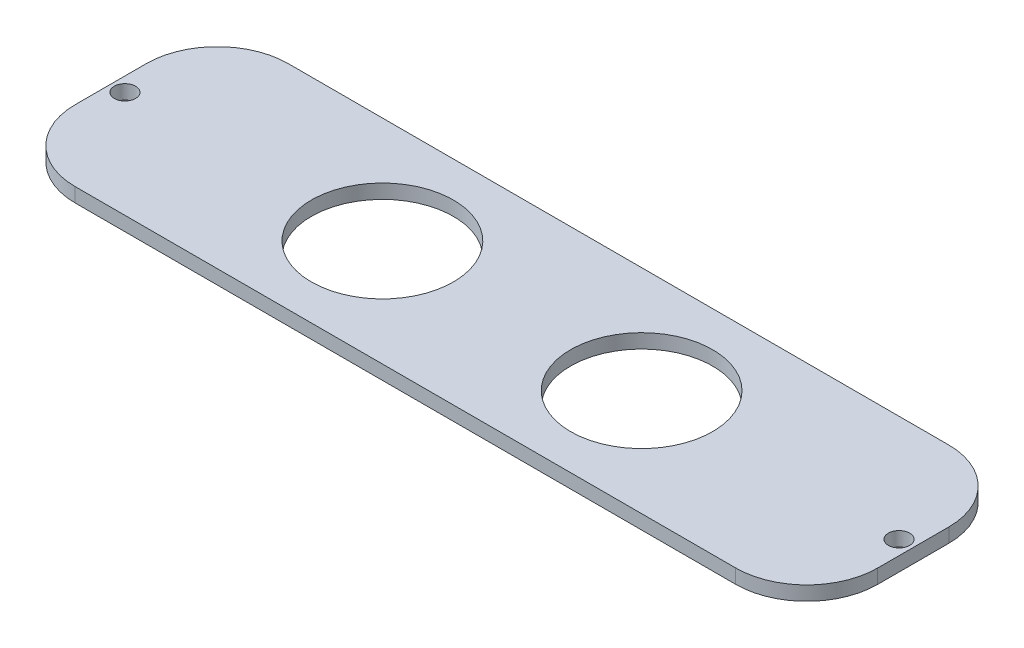
from build123d import *

# Parameters (mm, degrees)
SKETCH_1_R      = 10
SKETCH_1_R_2    = 1.5
EXTRUDE_1_DEPTH = 2


with BuildPart() as part:
    # 草图1 → 凸台-拉伸1 (new body)
    with BuildSketch(Plane(origin=(0, 0, 0), x_dir=(1, 0, 0), z_dir=(0, 1, 0))):
        with BuildLine():
            Line((-46.5, -15), (46.5, -15))
            ThreePointArc((46.5, -15), (53.571067812, -12.071067812), (56.5, -5))
            Line((56.5, -5), (56.5, 5))
            ThreePointArc((56.5, 5), (53.571067812, 12.071067812), (46.5, 15))
            Line((46.5, 15), (-46.5, 15))
            ThreePointArc((-46.5, 15), (-53.571067812, 12.071067812), (-56.5, 5))
            Line((-56.5, 5), (-56.5, -5))
            ThreePointArc((-56.5, -5), (-53.571067812, -12.071067812), (-46.5, -15))
        make_face()
        with Locations(Location((18.25, 0, 0), (0, 0, 270))):
            Circle(SKETCH_1_R, mode=Mode.SUBTRACT)
        with Locations(Location((-18.25, 0, 0), (0, 0, 270))):
            Circle(SKETCH_1_R, mode=Mode.SUBTRACT)
        with Locations(Location((-54.5, 0, 0), (0, 0, 270))):
            Circle(SKETCH_1_R_2, mode=Mode.SUBTRACT)
        with Locations(Location((54.5, 0, 0), (0, 0, 270))):
            Circle(SKETCH_1_R_2, mode=Mode.SUBTRACT)
    extrude(amount=EXTRUDE_1_DEPTH)


solid = part.part
